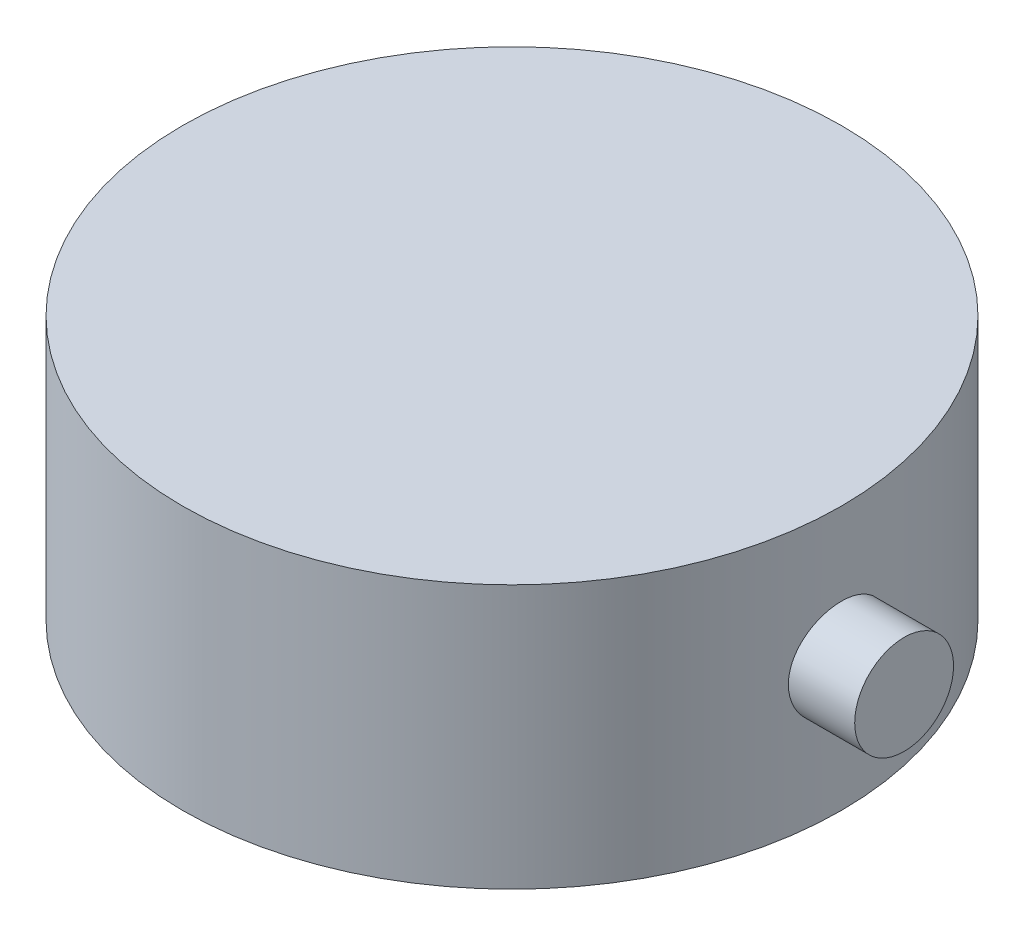
from build123d import *

# Parameters (mm, degrees)
SKIZZE1_R                          = 50
AUFSATZ_LINEAR_AUSTRAGEN1_DEPTH    = 20
SKIZZE2_R                          = 40
SCHNITT_LINEAR_AUSTRAGEN1_DEPTH    = 5
SKIZZE3_R                          = 7.5
AUFSATZ_LINEAR_AUSTRAGEN2_DEPTH    = 59.5
SKALIEREN1_SCALE                   = 0.75
K_RPER_VERSCHIEBEN_KOPIEREN1_ANGLE = 120


with BuildPart() as part:
    # Skizze1 → Aufsatz-Linear austragen1 (new, symmetric)
    with BuildSketch(Plane(origin=(0, 0, 0), x_dir=(0, 1, 0), z_dir=(0, 0, 1))):
        with Locations(Location((0, 0, 0), (0, 0, 270))):
            Circle(SKIZZE1_R)
    extrude(amount=AUFSATZ_LINEAR_AUSTRAGEN1_DEPTH, both=True)

    # Skizze2 → Schnitt-Linear austragen1 (cut)
    with BuildSketch(Plane.XY.offset(20)):
        Circle(SKIZZE2_R)
    extrude(amount=-SCHNITT_LINEAR_AUSTRAGEN1_DEPTH, mode=Mode.SUBTRACT)

    # Skizze3 → Aufsatz-Linear austragen2 (add, symmetric)
    with BuildSketch(Plane(origin=(0, 0, 0), x_dir=(-1, 0, 0), z_dir=(0, 1, 0))):
        with Locations(Location((0, 0, 0), (0, 0, 270))):
            Circle(SKIZZE3_R)
    extrude(amount=AUFSATZ_LINEAR_AUSTRAGEN2_DEPTH, both=True)


with BuildPart() as part_1:
    # Skalieren1: scaled about (4.8248e-05, 1e-09, -1.504015825)
    add(part.part.scale(SKALIEREN1_SCALE).moved(Location((1.2062e-05, 0, -0.376003956))))


with BuildPart() as part_2:
    # Körper-Verschieben/Kopieren1: moved
    add(part_1.part.rotate(Axis((0, 0, 0), (0.5773502691896928, 0.5773502691894897, -0.5773502691896948)), K_RPER_VERSCHIEBEN_KOPIEREN1_ANGLE))


solid = part_2.part
